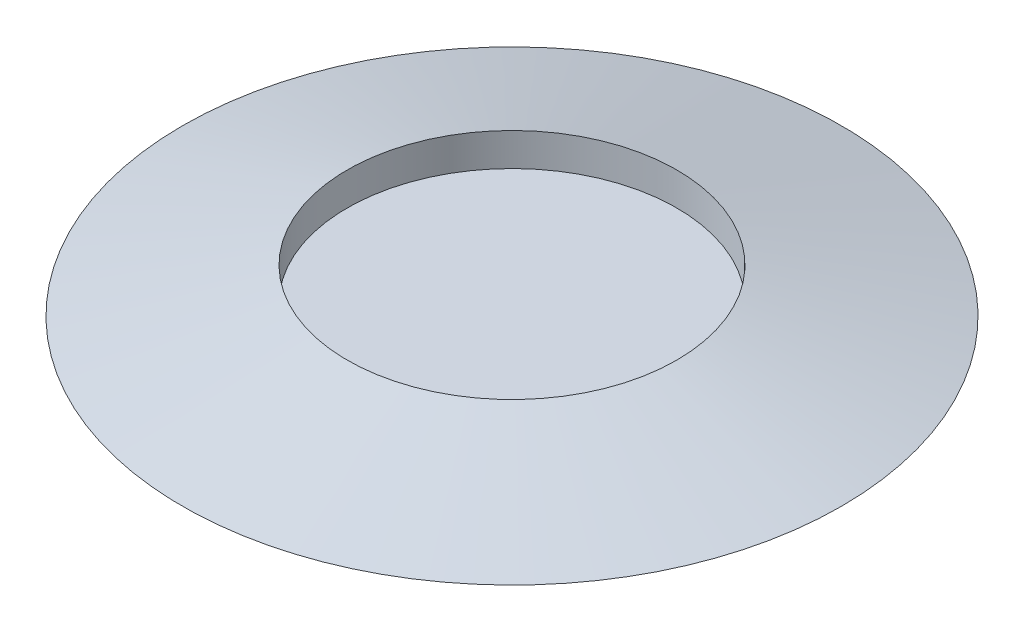
from build123d import *


with BuildPart() as part:
    # Sketch1 → Revolve1 (revolve)
    with BuildSketch(Plane.XY, mode=Mode.PRIVATE) as revolve1_sk:
        Polygon((-200, 0), (0, 0), (0, 6.794919243), (-100, 6.794919243), (-100, 26.794919243), align=None)
    revolve(revolve1_sk.sketch.rotate(Axis((0, 0, 0), (0, 1, 0)), 180), axis=Axis((0, 0, 0), (0, 1, 0)))


solid = part.part
